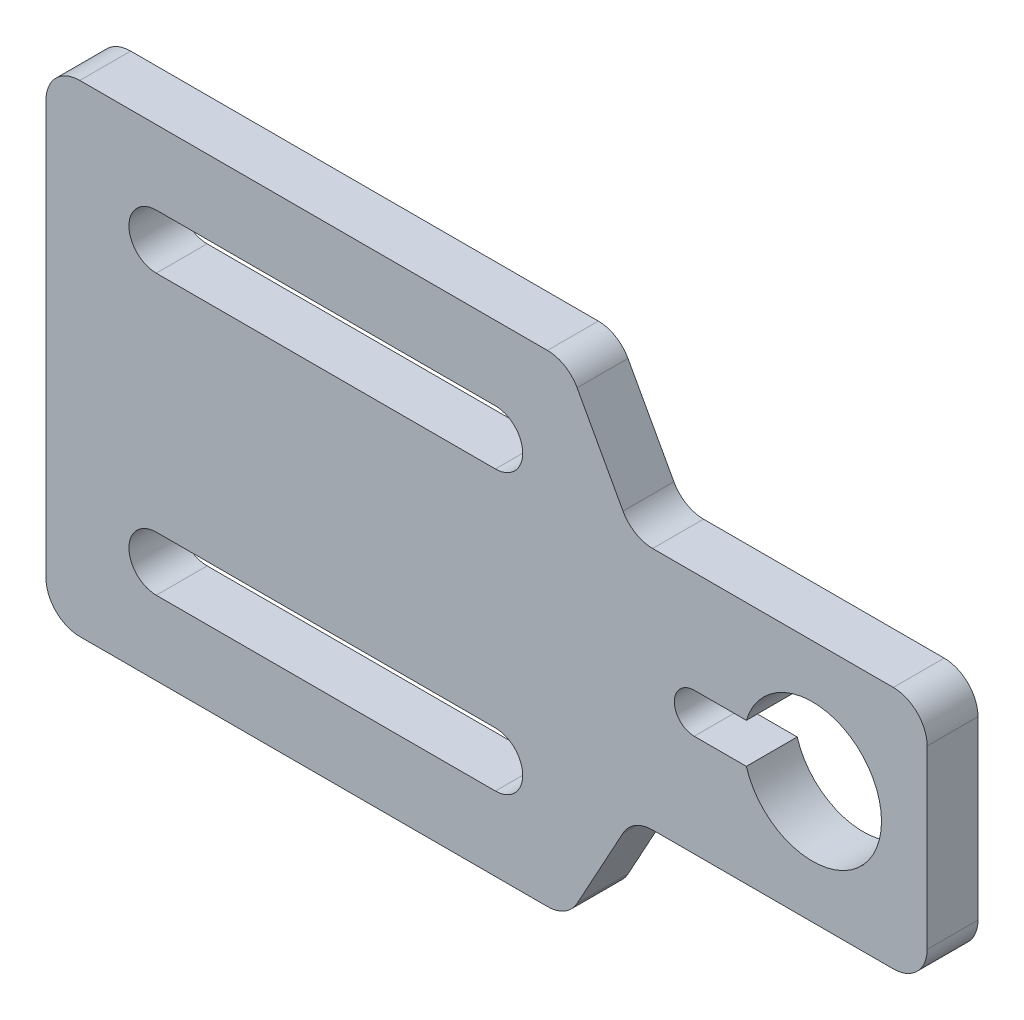
from build123d import *

# Parameters (mm, degrees)
EXTRUDE1_DEPTH = 4.7752


with BuildPart() as part:
    # Sketch1 → Extrude1 (new body)
    with BuildSketch(Plane.XY):
        with BuildLine():
            Line((0, 42.047652439), (0, 3.175))
            ThreePointArc((0, 3.175), (0.92993597, 0.92993597), (3.175, 0))
            Line((3.175, 0), (47.081976454, 0))
            ThreePointArc((47.081976454, 0), (48.700425311, 0.443471436), (49.866757105, 1.650001072))
            Line((49.866757105, 1.650001072), (54.175007162, 9.517240307))
            ThreePointArc((54.175007162, 9.517240307), (55.341338955, 10.723769944), (56.959787812, 11.167241379))
            Line((56.959787812, 11.167241379), (79.555795926, 11.167241379))
            ThreePointArc((79.555795926, 11.167241379), (81.800859957, 12.097177349), (82.730795926, 14.342241379))
            Line((82.730795926, 14.342241379), (82.730795926, 30.88041106))
            ThreePointArc((82.730795926, 30.88041106), (81.800859957, 33.12547509), (79.555795926, 34.05541106))
            Line((79.555795926, 34.05541106), (56.959787812, 34.05541106))
            ThreePointArc((56.959787812, 34.05541106), (55.341338955, 34.498882496), (54.175007162, 35.705412132))
            Line((54.175007162, 35.705412132), (49.866757105, 43.572651367))
            ThreePointArc((49.866757105, 43.572651367), (48.700425311, 44.779181004), (47.081976454, 45.222652439))
            Line((47.081976454, 45.222652439), (3.175, 45.222652439))
            ThreePointArc((3.175, 45.222652439), (0.92993597, 44.29271647), (0, 42.047652439))
        make_face()
        with BuildLine():
            Line((65.754365641, 24.481484037), (60.865717892, 24.481484037))
            ThreePointArc((60.865717892, 24.481484037), (58.995560075, 22.61132622), (60.865717892, 20.741168403))
            Line((60.865717892, 20.741168403), (65.754365641, 20.741168403))
            ThreePointArc((65.754365641, 20.741168403), (78.445201373, 22.61132622), (65.754365641, 24.481484037))
        make_face(mode=Mode.SUBTRACT)
        with BuildLine():
            Line((10.353425124, 38.271016828), (42.192963273, 38.271016828))
            ThreePointArc((42.192963273, 38.271016828), (44.758567969, 35.705412132), (42.192963273, 33.139807437))
            Line((42.192963273, 33.139807437), (10.353425124, 33.139807437))
            ThreePointArc((10.353425124, 33.139807437), (7.787820428, 35.705412132), (10.353425124, 38.271016828))
        make_face(mode=Mode.SUBTRACT)
        with BuildLine():
            Line((10.353425124, 6.951635611), (42.192963273, 6.951635611))
            ThreePointArc((42.192963273, 6.951635611), (44.758567969, 9.517240307), (42.192963273, 12.082845003))
            Line((42.192963273, 12.082845003), (10.353425124, 12.082845003))
            ThreePointArc((10.353425124, 12.082845003), (7.787820428, 9.517240307), (10.353425124, 6.951635611))
        make_face(mode=Mode.SUBTRACT)
    extrude(amount=EXTRUDE1_DEPTH)


solid = part.part
